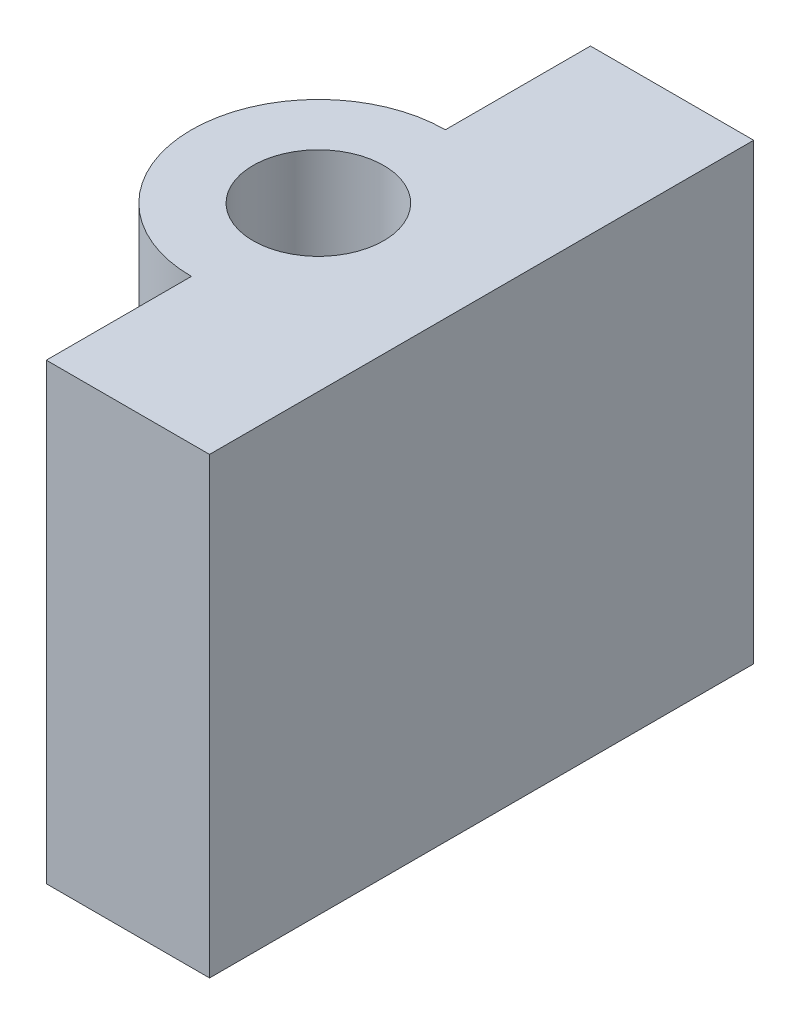
from build123d import *

# Parameters (mm, degrees)
SKETCH1_R           = 7
BOSS_EXTRUDE1_DEPTH = 25
SKETCH2_W           = 9
SKETCH2_H           = 30
BOSS_EXTRUDE2_DEPTH = 25
SKETCH3_R           = 3.6
CUT_EXTRUDE1_DEPTH  = 31.512292605


with BuildPart() as part:
    # Sketch1 → Boss-Extrude1 (new body)
    with BuildSketch(Plane(origin=(0, 0, 0), x_dir=(1, 0, 0), z_dir=(0, 1, 0))):
        Circle(SKETCH1_R)
    extrude(amount=BOSS_EXTRUDE1_DEPTH)

    # Sketch2 → Boss-Extrude2 (add)
    with BuildSketch(Plane(origin=(0, 25, 0), x_dir=(1, 0, 0), z_dir=(0, 1, 0))):
        with Locations((4.5, 0)):
            Rectangle(SKETCH2_W, SKETCH2_H)
    extrude(amount=-BOSS_EXTRUDE2_DEPTH)

    # Sketch3 → Cut-Extrude1 (cut, through all)
    with BuildSketch(Plane(origin=(0, 25, 0), x_dir=(1, 0, 0), z_dir=(0, 1, 0))):
        Circle(SKETCH3_R)
    extrude(amount=-CUT_EXTRUDE1_DEPTH, mode=Mode.SUBTRACT)


solid = part.part
